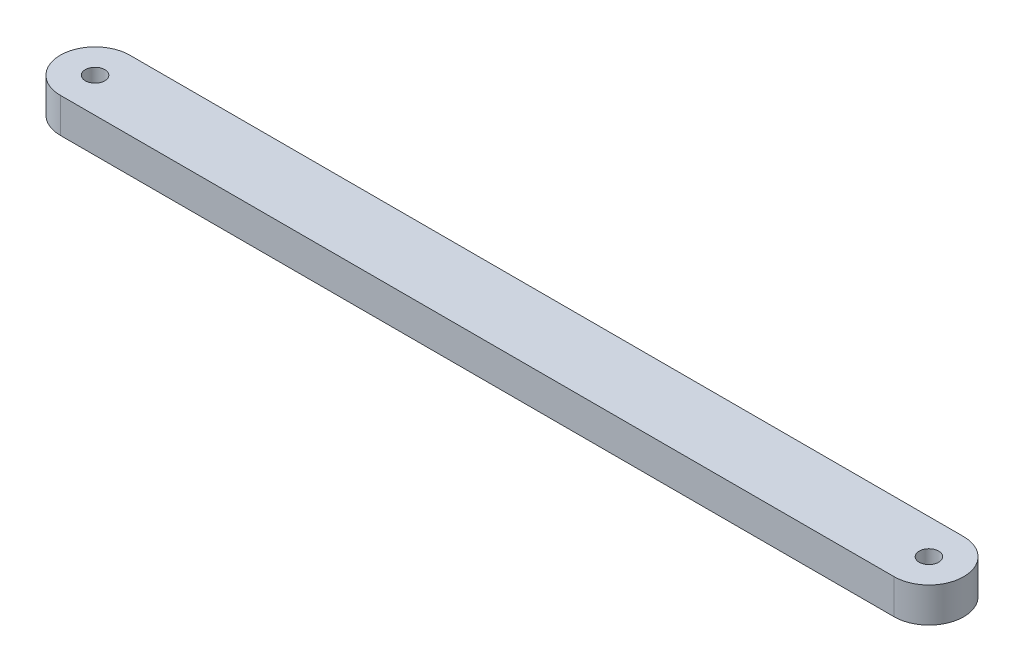
from build123d import *

# Parameters (mm, degrees)
SKETCH1_R           = 1.4
BOSS_EXTRUDE1_DEPTH = 5


with BuildPart() as part:
    # Sketch1 → Boss-Extrude1 (new body)
    with BuildSketch(Plane(origin=(0, 0, 0), x_dir=(1, 0, 0), z_dir=(0, 1, 0))):
        with BuildLine():
            Line((0, 5), (120, 5))
            ThreePointArc((120, 5), (125, 0), (120, -5))
            Line((120, -5), (0, -5))
            ThreePointArc((0, -5), (-5, 0), (0, 5))
        make_face()
        Circle(SKETCH1_R, mode=Mode.SUBTRACT)
        with Locations((120, 0)):
            Circle(SKETCH1_R, mode=Mode.SUBTRACT)
    extrude(amount=BOSS_EXTRUDE1_DEPTH)


solid = part.part
